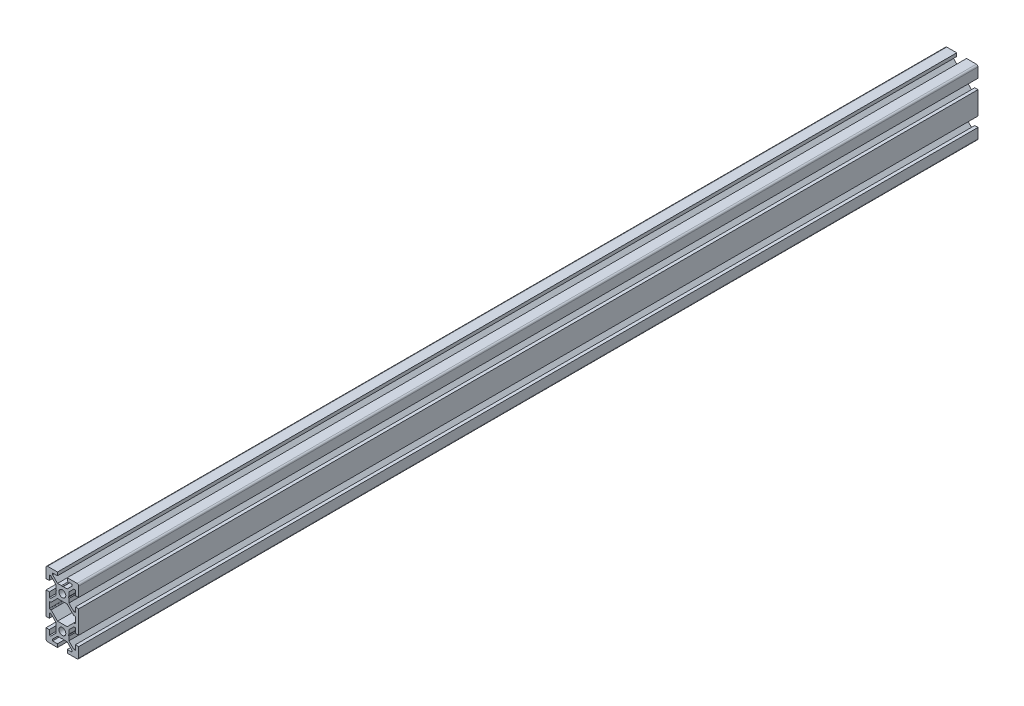
from build123d import *

# Parameters (mm, degrees)
BOSS_EXTRUDE1_DEPTH = 550
SKETCH2_W           = 550
SKETCH2_H           = 2.1
SKETCH3_W           = 550
SKETCH3_H           = 2.1


with BuildPart() as part:
    # Sketch1 → Boss-Extrude1 (new body)
    with BuildSketch(Plane.XY):
        with BuildLine():
            Line((-10, -7), (-8, -7))
            Line((-8, -7), (-8, -4))
            Line((-8, -4), (-7.060660172, -4))
            Line((-7.060660172, -4), (-4, -7.060660172))
            Line((-4, -7.060660172), (-4, -9.480384758))
            Line((-4, -9.480384758), (-3.7, -10))
            Line((-3.7, -10), (-4, -10.519615242))
            Line((-4, -10.519615242), (-4, -12.939339828))
            Line((-4, -12.939339828), (-7.060660172, -16))
            Line((-7.060660172, -16), (-8, -16))
            Line((-8, -16), (-8, -13))
            Line((-8, -13), (-10, -13))
            Line((-10, -13), (-10, -19))
            ThreePointArc((-10, -19), (-9.707106781, -19.707106781), (-9, -20))
            Line((-9, -20), (-3, -20))
            Line((-3, -20), (-3, -18))
            Line((-3, -18), (-6, -18))
            Line((-6, -18), (-6, -17.060660172))
            Line((-6, -17.060660172), (-2.939339828, -14))
            Line((-2.939339828, -14), (-0.519615242, -14))
            Line((-0.519615242, -14), (0, -13.7))
            Line((0, -13.7), (0.519615242, -14))
            Line((0.519615242, -14), (2.939339828, -14))
            Line((2.939339828, -14), (6, -17.060660172))
            Line((6, -17.060660172), (6, -18))
            Line((6, -18), (3, -18))
            Line((3, -18), (3, -20))
            Line((3, -20), (9, -20))
            ThreePointArc((9, -20), (9.707106781, -19.707106781), (10, -19))
            Line((10, -19), (10, -13))
            Line((10, -13), (8, -13))
            Line((8, -13), (8, -16))
            Line((8, -16), (7.060660172, -16))
            Line((7.060660172, -16), (4, -12.939339828))
            Line((4, -12.939339828), (4, -10.519615242))
            Line((4, -10.519615242), (3.7, -10))
            Line((3.7, -10), (4, -9.480384758))
            Line((4, -9.480384758), (4, -7.060660172))
            Line((4, -7.060660172), (7.060660172, -4))
            Line((7.060660172, -4), (8, -4))
            Line((8, -4), (8, -7))
            Line((8, -7), (10, -7))
            Line((10, -7), (10, 7))
            Line((10, 7), (8, 7))
            Line((8, 7), (8, 4))
            Line((8, 4), (7.060660172, 4))
            Line((7.060660172, 4), (4, 7.060660172))
            Line((4, 7.060660172), (4, 9.480384758))
            Line((4, 9.480384758), (3.7, 10))
            Line((3.7, 10), (4, 10.519615242))
            Line((4, 10.519615242), (4, 12.939339828))
            Line((4, 12.939339828), (7.060660172, 16))
            Line((7.060660172, 16), (8, 16))
            Line((8, 16), (8, 13))
            Line((8, 13), (10, 13))
            Line((10, 13), (10, 19))
            ThreePointArc((10, 19), (9.707106781, 19.707106781), (9, 20))
            Line((9, 20), (3, 20))
            Line((3, 20), (3, 18))
            Line((3, 18), (6, 18))
            Line((6, 18), (6, 17.060660172))
            Line((6, 17.060660172), (2.939339828, 14))
            Line((2.939339828, 14), (0.519615242, 14))
            Line((0.519615242, 14), (0, 13.7))
            Line((0, 13.7), (-0.519615242, 14))
            Line((-0.519615242, 14), (-2.939339828, 14))
            Line((-2.939339828, 14), (-6, 17.060660172))
            Line((-6, 17.060660172), (-6, 18))
            Line((-6, 18), (-3, 18))
            Line((-3, 18), (-3, 20))
            Line((-3, 20), (-9, 20))
            ThreePointArc((-9, 20), (-9.707106781, 19.707106781), (-10, 19))
            Line((-10, 19), (-10, 13))
            Line((-10, 13), (-8, 13))
            Line((-8, 13), (-8, 16))
            Line((-8, 16), (-7.060660172, 16))
            Line((-7.060660172, 16), (-4, 12.939339828))
            Line((-4, 12.939339828), (-4, 10.519615242))
            Line((-4, 10.519615242), (-3.7, 10))
            Line((-3.7, 10), (-4, 9.480384758))
            Line((-4, 9.480384758), (-4, 7.060660172))
            Line((-4, 7.060660172), (-7.060660172, 4))
            Line((-7.060660172, 4), (-8, 4))
            Line((-8, 4), (-8, 7))
            Line((-8, 7), (-10, 7))
            Line((-10, 7), (-10, -7))
        make_face()
        with BuildLine():
            Line((-8, 1.7), (-8, -1.7))
            ThreePointArc((-8, -1.7), (-7.912132034, -1.912132034), (-7.7, -2))
            Line((-7.7, -2), (-7.063603897, -2))
            ThreePointArc((-7.063603897, -2), (-6.948798867, -2.02283614), (-6.851471863, -2.087867966))
            Line((-6.851471863, -2.087867966), (-2.939339828, -6))
            Line((-2.939339828, -6), (2.939339828, -6))
            Line((2.939339828, -6), (6.851471863, -2.087867966))
            ThreePointArc((6.851471863, -2.087867966), (6.948798867, -2.02283614), (7.063603897, -2))
            Line((7.063603897, -2), (7.7, -2))
            ThreePointArc((7.7, -2), (7.912132034, -1.912132034), (8, -1.7))
            Line((8, -1.7), (8, 1.7))
            ThreePointArc((8, 1.7), (7.912132034, 1.912132034), (7.7, 2))
            Line((7.7, 2), (7.063603897, 2))
            ThreePointArc((7.063603897, 2), (6.948798867, 2.02283614), (6.851471863, 2.087867966))
            Line((6.851471863, 2.087867966), (2.939339828, 6))
            Line((2.939339828, 6), (-2.939339828, 6))
            Line((-2.939339828, 6), (-6.851471863, 2.087867966))
            ThreePointArc((-6.851471863, 2.087867966), (-6.948798867, 2.02283614), (-7.063603897, 2))
            Line((-7.063603897, 2), (-7.7, 2))
            ThreePointArc((-7.7, 2), (-7.912132034, 1.912132034), (-8, 1.7))
        make_face(mode=Mode.SUBTRACT)
    extrude(amount=-BOSS_EXTRUDE1_DEPTH)

    # Sketch2 → Cut-Revolve1 (revolve, cut)
    with BuildSketch(Plane(origin=(0, 0, 0), x_dir=(0, 0, -1), z_dir=(1, 0, 0)), mode=Mode.PRIVATE) as cut_revolve1_sk:
        with Locations((275, 11.05)):
            Rectangle(SKETCH2_W, SKETCH2_H)
    revolve(cut_revolve1_sk.sketch.rotate(Axis((0, 10, -550), (0, 0, 1)), 270), axis=Axis((0, 10, -550), (0, 0, 1)), mode=Mode.SUBTRACT)

    # Sketch3 → Cut-Revolve2 (revolve, cut)
    with BuildSketch(Plane(origin=(0, 0, 0), x_dir=(0, 0, -1), z_dir=(1, 0, 0)), mode=Mode.PRIVATE) as cut_revolve2_sk:
        with Locations((275, -8.95)):
            Rectangle(SKETCH3_W, SKETCH3_H)
    revolve(cut_revolve2_sk.sketch.rotate(Axis((0, -10, -550), (0, 0, 1)), 270), axis=Axis((0, -10, -550), (0, 0, 1)), mode=Mode.SUBTRACT)


solid = part.part
